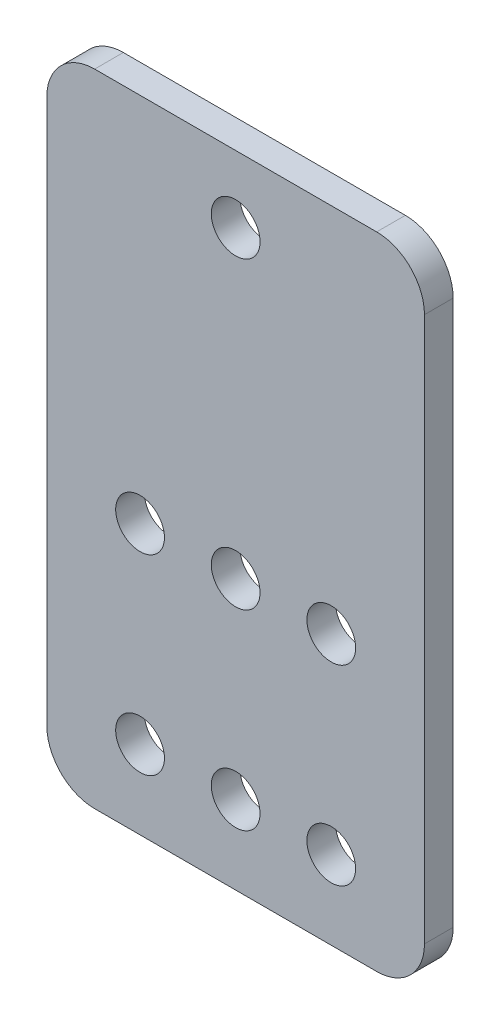
from build123d import *

# Parameters (mm, degrees)
SKETCH1_R           = 2.55
BOSS_EXTRUDE1_DEPTH = 3


with BuildPart() as part:
    # Sketch1 → Boss-Extrude1 (new body)
    with BuildSketch(Plane.XY):
        with BuildLine():
            Line((-14.75, -33.5), (14.75, -33.5))
            ThreePointArc((14.75, -33.5), (18.285533906, -32.035533906), (19.75, -28.5))
            Line((19.75, -28.5), (19.75, 28.5))
            ThreePointArc((19.75, 28.5), (18.285533906, 32.035533906), (14.75, 33.5))
            Line((14.75, 33.5), (-14.75, 33.5))
            ThreePointArc((-14.75, 33.5), (-18.285533906, 32.035533906), (-19.75, 28.5))
            Line((-19.75, 28.5), (-19.75, -28.5))
            ThreePointArc((-19.75, -28.5), (-18.285533906, -32.035533906), (-14.75, -33.5))
        make_face()
        with Locations((9.999993248, -5.29)):
            Circle(SKETCH1_R, mode=Mode.SUBTRACT)
        with Locations((0, -5.29)):
            Circle(SKETCH1_R, mode=Mode.SUBTRACT)
        with Locations((-9.999993248, -5.29)):
            Circle(SKETCH1_R, mode=Mode.SUBTRACT)
        with Locations((6.771e-06, -25.29)):
            Circle(SKETCH1_R, mode=Mode.SUBTRACT)
        with Locations((-9.999986477, -25.29)):
            Circle(SKETCH1_R, mode=Mode.SUBTRACT)
        with Locations((10.000000018, -25.29)):
            Circle(SKETCH1_R, mode=Mode.SUBTRACT)
        with Locations((0, 26.5)):
            Circle(SKETCH1_R, mode=Mode.SUBTRACT)
    extrude(amount=BOSS_EXTRUDE1_DEPTH)


solid = part.part
